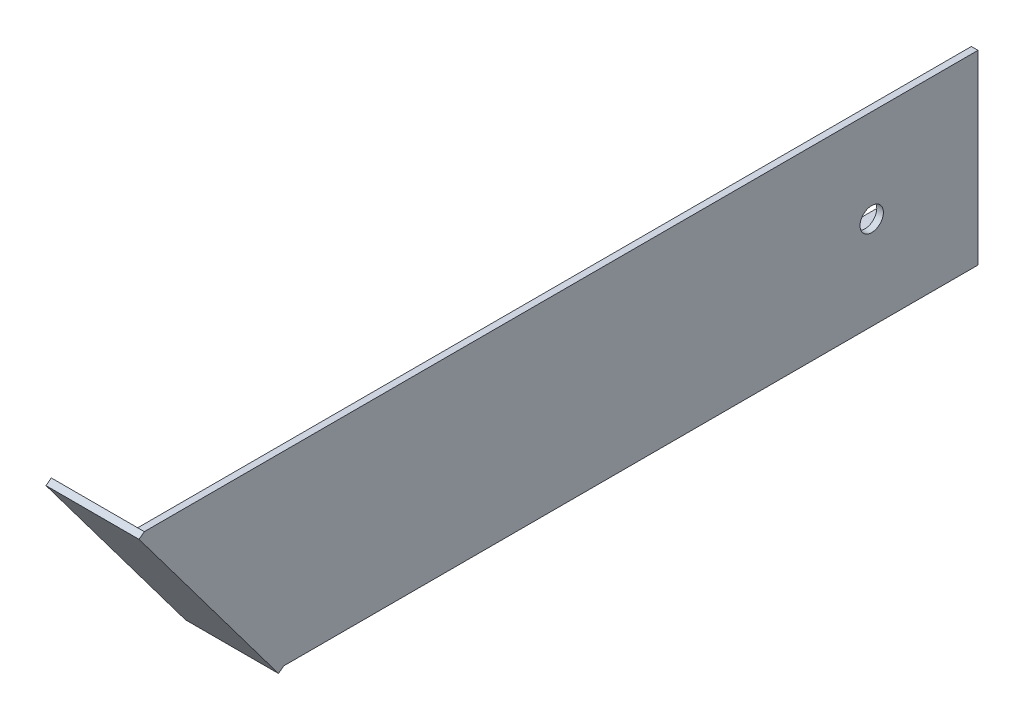
from build123d import *

# Parameters (mm, degrees)
BOSS_EXTRUDE1_DEPTH     = 199.23125
CUT_EXTRUDE3_DEPTH      = 223.035867827
CUT_EXTRUDE3_DEPTH_BACK = 223.035867827
SKETCH4_R               = 5.588
SKETCH5_W               = 44.45
SKETCH5_H               = 111.125148887
BOSS_EXTRUDE3_DEPTH     = 3.175


with BuildPart() as part:
    # Sketch1 → Boss-Extrude1 (new, symmetric)
    with BuildSketch(Plane.XY):
        Polygon((3.175, 88.9), (3.175, 3.175), (44.45, 3.175), (44.45, 0), (0, 0), (0, 88.9), align=None)
    extrude(amount=BOSS_EXTRUDE1_DEPTH, both=True)

    # Sketch4 → Cut-Extrude3 (cut, two sides: drawn at the far end of the back side and taken through both)
    with BuildSketch(Plane(origin=(3.175, 0, 0), x_dir=(0, 0, -1), z_dir=(1, 0, 0)).offset(-CUT_EXTRUDE3_DEPTH_BACK)):
        with Locations(Location((148.43125, 44.45, 0), (0, 0, 270))):
            Circle(SKETCH4_R)
        Polygon((-199.23125, 88.9), (-132.556001855, 0), (-199.23125, 0), align=None)
    extrude(amount=CUT_EXTRUDE3_DEPTH + CUT_EXTRUDE3_DEPTH_BACK, mode=Mode.SUBTRACT)

    # Sketch5 → Boss-Extrude3 (add)
    with BuildSketch(Plane(origin=(0, -63.626947194, 84.835613859), x_dir=(1, 0, 0), z_dir=(0, -0.6000014291326674, 0.7999989281485049))):
        with Locations((22.225, 135.096364997)):
            Rectangle(SKETCH5_W, SKETCH5_H)
    extrude(amount=BOSS_EXTRUDE3_DEPTH)


with BuildPart() as body_2:
    # Mirror1: mirrored copy
    add(part.part.mirror(Plane(origin=(0, 0, 0), x_dir=(0, 0, 1), z_dir=(1, 0, 0))))


solid = body_2.part
